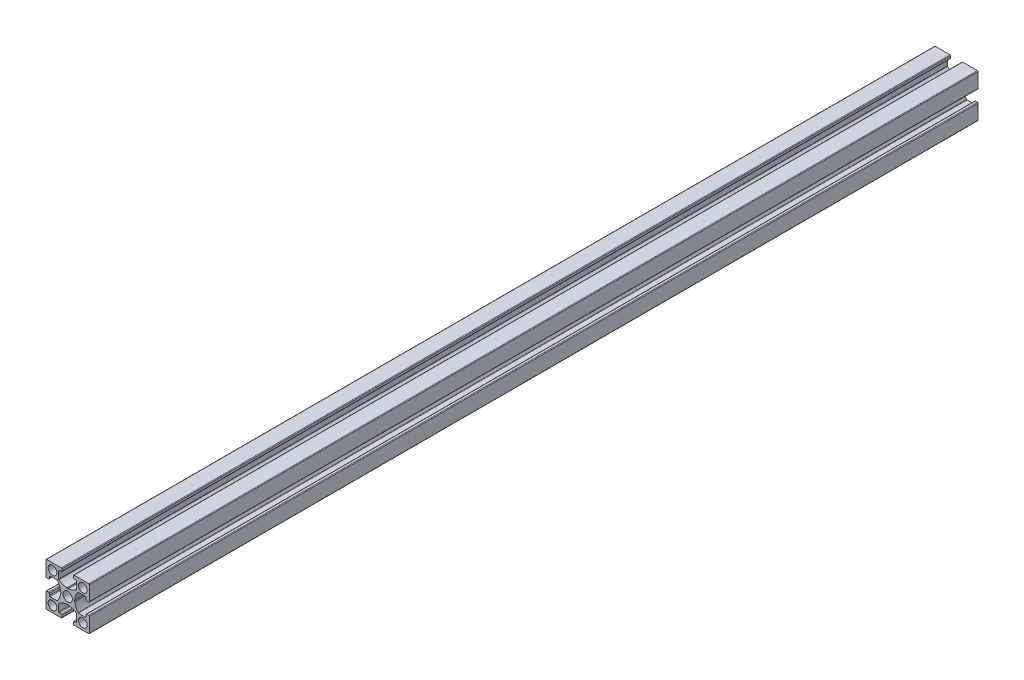
from build123d import *

# Parameters (mm, degrees)
MODEL_R         = 2.15
MODEL_R_2       = 2
EXTRUDE_1_DEPTH = 410


with BuildPart() as part:
    # Model → 보스-돌출1 (new body)
    with BuildSketch(Plane.XY):
        with BuildLine():
            Line((2307.763927197, 1192.134297913), (2307.763927197, 1195.391548465))
            ThreePointArc((2307.763927197, 1195.391548465), (2307.676059232, 1195.603680499), (2307.463927197, 1195.691548465))
            Line((2307.463927197, 1195.691548465), (2306.563927197, 1195.691548465))
            ThreePointArc((2306.563927197, 1195.691548465), (2306.351795163, 1195.779416431), (2306.263927197, 1195.991548465))
            Line((2306.263927197, 1195.991548465), (2306.263927197, 1196.891548465))
            ThreePointArc((2306.263927197, 1196.891548465), (2306.351795163, 1197.103680499), (2306.563927197, 1197.191548465))
            Line((2306.563927197, 1197.191548465), (2313.313927197, 1197.191548465))
            ThreePointArc((2313.313927197, 1197.191548465), (2313.526059232, 1197.103680499), (2313.613927197, 1196.891548465))
            Line((2313.613927197, 1196.891548465), (2313.613927197, 1190.141548465))
            ThreePointArc((2313.613927197, 1190.141548465), (2313.526059232, 1189.929416431), (2313.313927197, 1189.841548465))
            Line((2313.313927197, 1189.841548465), (2312.413927197, 1189.841548465))
            ThreePointArc((2312.413927197, 1189.841548465), (2312.201795163, 1189.929416431), (2312.113927197, 1190.141548465))
            Line((2312.113927197, 1190.141548465), (2312.113927197, 1191.041548465))
            ThreePointArc((2312.113927197, 1191.041548465), (2312.026059232, 1191.253680499), (2311.813927197, 1191.341548465))
            Line((2311.813927197, 1191.341548465), (2308.556676645, 1191.341548465))
            ThreePointArc((2308.556676645, 1191.341548465), (2308.426234796, 1191.311705686), (2308.321744595, 1191.228114625))
            ThreePointArc((2308.321744595, 1191.228114625), (2307.328306374, 1189.47356999), (2306.921204563, 1187.498825831))
            Line((2306.921204563, 1187.498825831), (2306.613927197, 1187.191548465))
            Line((2306.613927197, 1187.191548465), (2306.921204563, 1186.884271099))
            ThreePointArc((2306.921204563, 1186.884271099), (2307.328306374, 1184.90952694), (2308.321744595, 1183.154982305))
            ThreePointArc((2308.321744595, 1183.154982305), (2308.426234796, 1183.071391244), (2308.556676645, 1183.041548465))
            Line((2308.556676645, 1183.041548465), (2311.813927197, 1183.041548465))
            ThreePointArc((2311.813927197, 1183.041548465), (2312.026059232, 1183.129416431), (2312.113927197, 1183.341548465))
            Line((2312.113927197, 1183.341548465), (2312.113927197, 1184.241548465))
            ThreePointArc((2312.113927197, 1184.241548465), (2312.201795163, 1184.453680499), (2312.413927197, 1184.541548465))
            Line((2312.413927197, 1184.541548465), (2313.313927197, 1184.541548465))
            ThreePointArc((2313.313927197, 1184.541548465), (2313.526059232, 1184.453680499), (2313.613927197, 1184.241548465))
            Line((2313.613927197, 1184.241548465), (2313.613927197, 1177.491548465))
            ThreePointArc((2313.613927197, 1177.491548465), (2313.526059232, 1177.279416431), (2313.313927197, 1177.191548465))
            Line((2313.313927197, 1177.191548465), (2306.563927197, 1177.191548465))
            ThreePointArc((2306.563927197, 1177.191548465), (2306.351795163, 1177.279416431), (2306.263927197, 1177.491548465))
            Line((2306.263927197, 1177.491548465), (2306.263927197, 1178.391548465))
            ThreePointArc((2306.263927197, 1178.391548465), (2306.351795163, 1178.603680499), (2306.563927197, 1178.691548465))
            Line((2306.563927197, 1178.691548465), (2307.463927197, 1178.691548465))
            ThreePointArc((2307.463927197, 1178.691548465), (2307.676059232, 1178.779416431), (2307.763927197, 1178.991548465))
            Line((2307.763927197, 1178.991548465), (2307.763927197, 1182.248799017))
            ThreePointArc((2307.763927197, 1182.248799017), (2307.734084418, 1182.379240866), (2307.650493357, 1182.483731067))
            ThreePointArc((2307.650493357, 1182.483731067), (2305.895948722, 1183.477169289), (2303.921204563, 1183.884271099))
            Line((2303.921204563, 1183.884271099), (2303.613927197, 1184.191548465))
            Line((2303.613927197, 1184.191548465), (2303.306649831, 1183.884271099))
            ThreePointArc((2303.306649831, 1183.884271099), (2301.331905673, 1183.477169289), (2299.577361038, 1182.483731067))
            ThreePointArc((2299.577361038, 1182.483731067), (2299.493769977, 1182.379240866), (2299.463927197, 1182.248799017))
            Line((2299.463927197, 1182.248799017), (2299.463927197, 1178.991548465))
            ThreePointArc((2299.463927197, 1178.991548465), (2299.551795163, 1178.779416431), (2299.763927197, 1178.691548465))
            Line((2299.763927197, 1178.691548465), (2300.663927197, 1178.691548465))
            ThreePointArc((2300.663927197, 1178.691548465), (2300.876059232, 1178.603680499), (2300.963927197, 1178.391548465))
            Line((2300.963927197, 1178.391548465), (2300.963927197, 1177.491548465))
            ThreePointArc((2300.963927197, 1177.491548465), (2300.876059232, 1177.279416431), (2300.663927197, 1177.191548465))
            Line((2300.663927197, 1177.191548465), (2293.913927197, 1177.191548465))
            ThreePointArc((2293.913927197, 1177.191548465), (2293.701795163, 1177.279416431), (2293.613927197, 1177.491548465))
            Line((2293.613927197, 1177.491548465), (2293.613927197, 1184.241548465))
            ThreePointArc((2293.613927197, 1184.241548465), (2293.701795163, 1184.453680499), (2293.913927197, 1184.541548465))
            Line((2293.913927197, 1184.541548465), (2294.813927197, 1184.541548465))
            ThreePointArc((2294.813927197, 1184.541548465), (2295.026059232, 1184.453680499), (2295.113927197, 1184.241548465))
            Line((2295.113927197, 1184.241548465), (2295.113927197, 1183.341548465))
            ThreePointArc((2295.113927197, 1183.341548465), (2295.201795163, 1183.129416431), (2295.413927197, 1183.041548465))
            Line((2295.413927197, 1183.041548465), (2298.671177749, 1183.041548465))
            ThreePointArc((2298.671177749, 1183.041548465), (2298.801619599, 1183.071391244), (2298.906109799, 1183.154982305))
            ThreePointArc((2298.906109799, 1183.154982305), (2299.899548021, 1184.90952694), (2300.306649831, 1186.884271099))
            Line((2300.306649831, 1186.884271099), (2300.613927197, 1187.191548465))
            Line((2300.613927197, 1187.191548465), (2300.306649831, 1187.498825831))
            ThreePointArc((2300.306649831, 1187.498825831), (2299.899548021, 1189.47356999), (2298.906109799, 1191.228114625))
            ThreePointArc((2298.906109799, 1191.228114625), (2298.801619599, 1191.311705686), (2298.671177749, 1191.341548465))
            Line((2298.671177749, 1191.341548465), (2295.413927197, 1191.341548465))
            ThreePointArc((2295.413927197, 1191.341548465), (2295.201795163, 1191.253680499), (2295.113927197, 1191.041548465))
            Line((2295.113927197, 1191.041548465), (2295.113927197, 1190.141548465))
            ThreePointArc((2295.113927197, 1190.141548465), (2295.026059232, 1189.929416431), (2294.813927197, 1189.841548465))
            Line((2294.813927197, 1189.841548465), (2293.913927197, 1189.841548465))
            ThreePointArc((2293.913927197, 1189.841548465), (2293.701795163, 1189.929416431), (2293.613927197, 1190.141548465))
            Line((2293.613927197, 1190.141548465), (2293.613927197, 1196.891548465))
            ThreePointArc((2293.613927197, 1196.891548465), (2293.701795163, 1197.103680499), (2293.913927197, 1197.191548465))
            Line((2293.913927197, 1197.191548465), (2300.663927197, 1197.191548465))
            ThreePointArc((2300.663927197, 1197.191548465), (2300.876059232, 1197.103680499), (2300.963927197, 1196.891548465))
            Line((2300.963927197, 1196.891548465), (2300.963927197, 1195.991548465))
            ThreePointArc((2300.963927197, 1195.991548465), (2300.876059232, 1195.779416431), (2300.663927197, 1195.691548465))
            Line((2300.663927197, 1195.691548465), (2299.763927197, 1195.691548465))
            ThreePointArc((2299.763927197, 1195.691548465), (2299.551795163, 1195.603680499), (2299.463927197, 1195.391548465))
            Line((2299.463927197, 1195.391548465), (2299.463927197, 1192.134297913))
            ThreePointArc((2299.463927197, 1192.134297913), (2299.493769977, 1192.003856063), (2299.577361038, 1191.899365863))
            ThreePointArc((2299.577361038, 1191.899365863), (2301.331905673, 1190.905927641), (2303.306649831, 1190.498825831))
            Line((2303.306649831, 1190.498825831), (2303.613927197, 1190.191548465))
            Line((2303.613927197, 1190.191548465), (2303.921204563, 1190.498825831))
            ThreePointArc((2303.921204563, 1190.498825831), (2305.895948722, 1190.905927641), (2307.650493357, 1191.899365863))
            ThreePointArc((2307.650493357, 1191.899365863), (2307.734084418, 1192.003856063), (2307.763927197, 1192.134297913))
        make_face()
        with Locations(Location((2303.613927197, 1187.191548465, 0), (0, 0, 180))):
            Circle(MODEL_R, mode=Mode.SUBTRACT)
        with Locations(Location((2296.613927197, 1194.191548465, 0), (0, 0, 180))):
            Circle(MODEL_R_2, mode=Mode.SUBTRACT)
        with Locations(Location((2296.613927197, 1180.191548465, 0), (0, 0, 180))):
            Circle(MODEL_R_2, mode=Mode.SUBTRACT)
        with Locations(Location((2310.613927197, 1194.191548465, 0), (0, 0, 180))):
            Circle(MODEL_R_2, mode=Mode.SUBTRACT)
        with Locations(Location((2310.613927197, 1180.191548465, 0), (0, 0, 180))):
            Circle(MODEL_R_2, mode=Mode.SUBTRACT)
    extrude(amount=EXTRUDE_1_DEPTH)


solid = part.part
